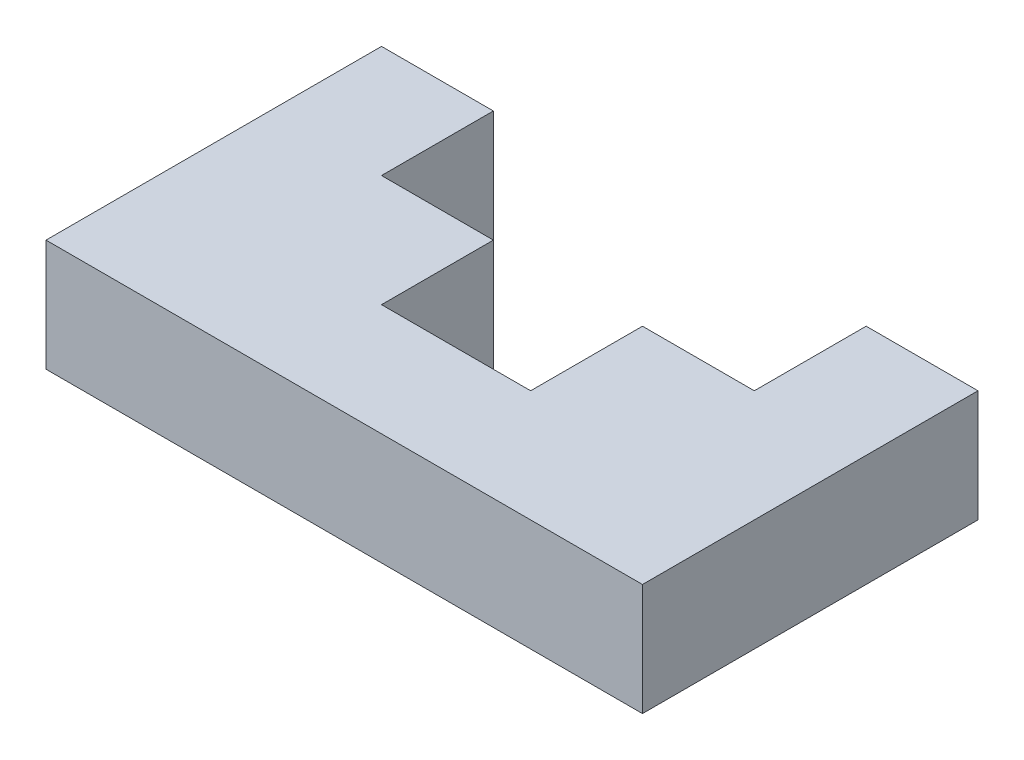
from build123d import *

# Parameters (mm, degrees)
EXTRUDE_2_DEPTH = 1.5


with BuildPart() as part:
    # 草图1 → 凸台-拉伸2 (new, symmetric)
    with BuildSketch(Plane(origin=(0, 0, 0), x_dir=(1, 0, 0), z_dir=(0, 1, 0))):
        Polygon((8, 0), (8, -9), (-8, -9), (-8, 0), (-5, 0), (-5, -3), (-2, -3), (-2, -6), (2, -6), (2, -3), (5, -3), (5, 0), align=None)
    extrude(amount=EXTRUDE_2_DEPTH, both=True)


solid = part.part
